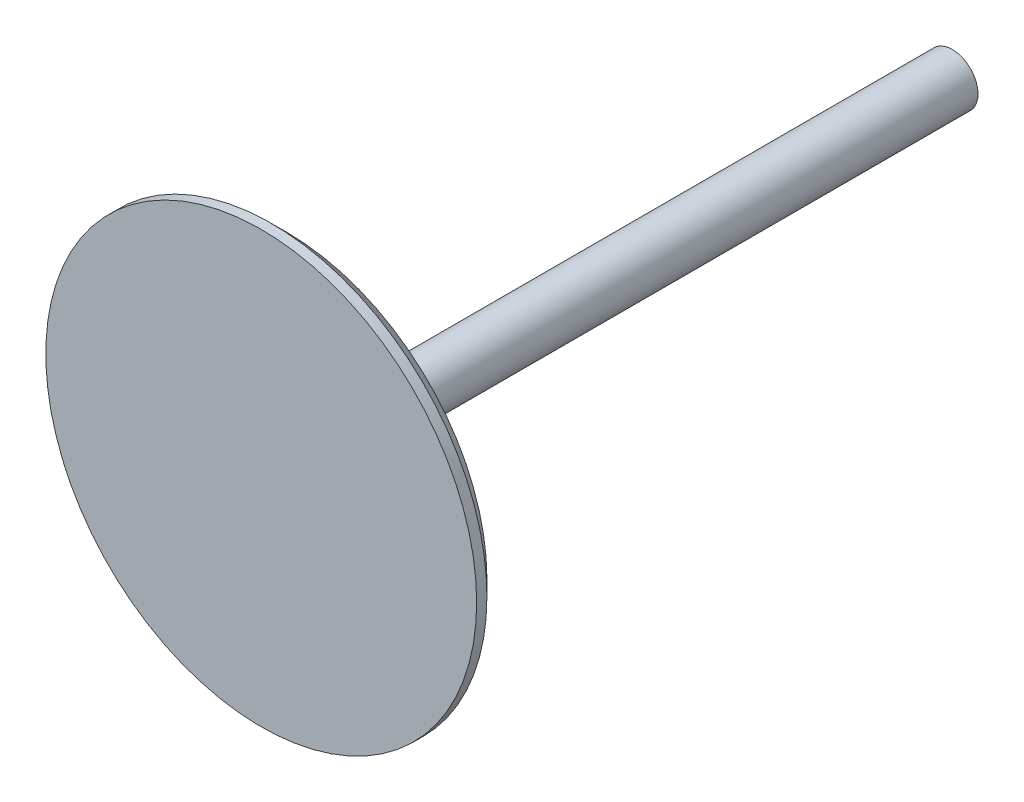
from build123d import *


with BuildPart() as part:
    # Sketch1 → Revolve1 (revolve)
    with BuildSketch(Plane(origin=(0, 0, 0), x_dir=(1, 0, 0), z_dir=(0, 1, 0))):
        with BuildLine():
            Line((0, 0), (0, 85.55))
            Line((0, 85.55), (3.18, 85.55))
            Line((3.18, 85.55), (3.18, 17.054206284))
            ThreePointArc((3.18, 17.054206284), (10.18287929, 4.226599336), (24.76, 3.18))
            Line((24.76, 3.18), (26.67, 1.27))
            Line((26.67, 1.27), (26.67, 0))
            Line((26.67, 0), (0, 0))
        make_face()
    revolve(axis=Axis((0, 0, 0), (0, 0, -1)))


solid = part.part
